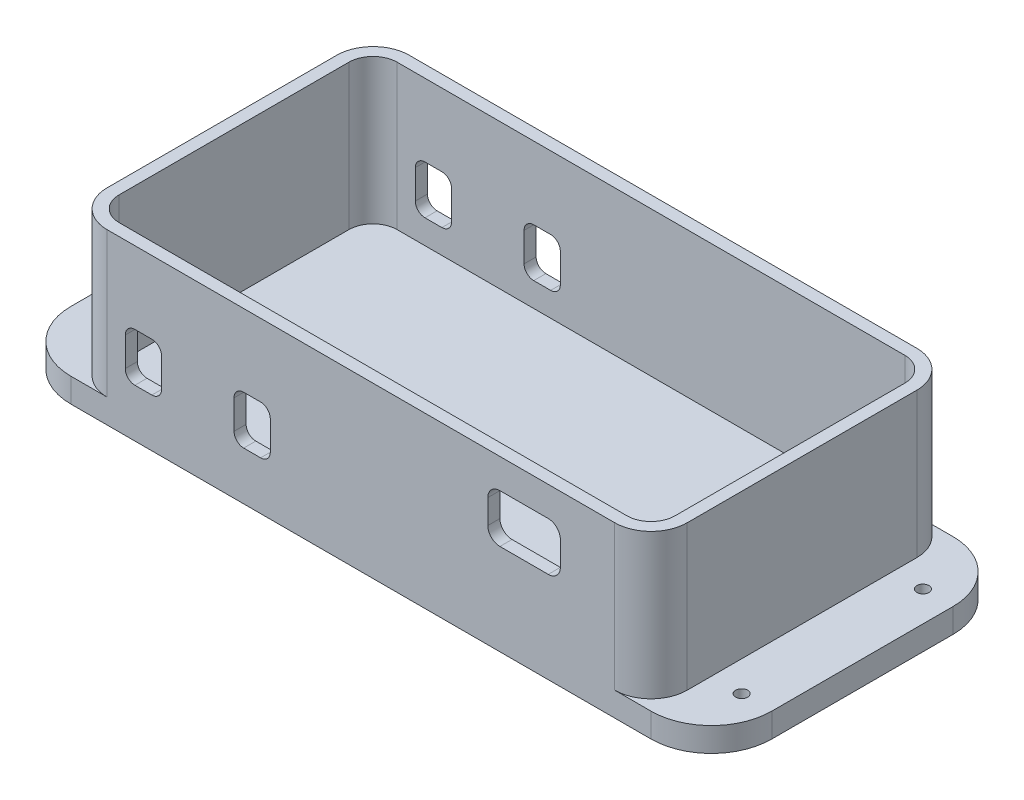
from build123d import *

# Parameters (mm, degrees)
SKETCH1_W            = 147.32
SKETCH1_H            = 63.5
BOSS_EXTRUDE3_DEPTH  = 5.08
FILLET4_R            = 12.7
SKETCH4_W            = 121.92
SKETCH4_H            = 63.5
SKETCH4_W_2          = 116.84
SKETCH4_H_2          = 58.42
BOSS_EXTRUDE4_DEPTH  = 30.48
SKETCH9_W            = 10.16
SKETCH9_H            = 10.16
BOSS_EXTRUDE5_DEPTH  = 5.08
FILLET9_R            = 5.08
SKETCH10_R           = 3.175
CUT_EXTRUDE7_DEPTH   = 163.421034352
FILLET12_R           = 7.62
SKETCH11_R           = 3.175
SKETCH11_R_2         = 1.27
BOSS_EXTRUDE7_DEPTH  = 5.08
SKETCH15_R           = 1.27
CUT_EXTRUDE10_DEPTH  = 2.54
BOSS_EXTRUDE9_START  = -2.54
SKETCH16_R           = 3.175
BOSS_EXTRUDE9_DEPTH  = 2.54
SKETCH17_W           = 116.84
SKETCH17_H           = 58.42
CUT_EXTRUDE11_DEPTH  = 5.08
SKETCH18_W           = 116.84
SKETCH18_H           = 58.42
BOSS_EXTRUDE10_DEPTH = 5.08
FILLET16_R           = 5.08
SKETCH13_W           = 7.62
SKETCH13_H           = 10.16
CUT_EXTRUDE12_DEPTH  = 165.316602935
FILLET17_R           = 2.032
CUT_EXTRUDE14_REACH  = 166.317
SKETCH12_W           = 15.24
SKETCH12_H           = 10.16
FILLET18_R           = 2.54


with BuildPart() as part:
    # Sketch1 → Boss-Extrude3 (new body)
    with BuildSketch(Plane(origin=(0, 0, 0), x_dir=(1, 0, 0), z_dir=(0, 1, 0))):
        with Locations((73.66, 31.75)):
            Rectangle(SKETCH1_W, SKETCH1_H)
    extrude(amount=BOSS_EXTRUDE3_DEPTH)

    # Fillet4
    fillet4_edges = [part.edges().sort_by_distance(p)[0] for p in [
        (0, 2.54, -63.5),
        (147.32, 2.54, -63.5),
        (147.32, 2.54, 0),
        (0, 2.54, 0),
    ]]
    fillet(fillet4_edges, radius=FILLET4_R)

    # Sketch4 → Boss-Extrude4 (add)
    with BuildSketch(Plane(origin=(0, 5.08, 0), x_dir=(1, 0, 0), z_dir=(0, 1, 0))):
        with Locations((73.66, 31.75)):
            Rectangle(SKETCH4_W, SKETCH4_H)
        with Locations((73.66, 31.75)):
            Rectangle(SKETCH4_W_2, SKETCH4_H_2, mode=Mode.SUBTRACT)
    extrude(amount=BOSS_EXTRUDE4_DEPTH)

    # Sketch9 → Boss-Extrude5 (add)
    with BuildSketch(Plane(origin=(0, 5.08, 0), x_dir=(1, 0, 0), z_dir=(0, 1, 0))):
        with Locations((20.32, 55.88)):
            Rectangle(SKETCH9_W, SKETCH9_H)
        with Locations((127, 55.88)):
            Rectangle(SKETCH9_W, SKETCH9_H)
        with Locations((127, 7.62)):
            Rectangle(SKETCH9_W, SKETCH9_H)
        with Locations((20.32, 7.62)):
            Rectangle(SKETCH9_W, SKETCH9_H)
    extrude(amount=BOSS_EXTRUDE5_DEPTH)

    # Fillet9
    fillet9_edges = [part.edges().sort_by_distance(p)[0] for p in [
        (25.4, 7.62, -12.7),
        (25.4, 7.62, -50.8),
        (121.92, 7.62, -50.8),
        (121.92, 7.62, -12.7),
    ]]
    fillet(fillet9_edges, radius=FILLET9_R)

    # Sketch10 → Cut-Extrude7 (cut, through all)
    with BuildSketch(Plane(origin=(0, 10.16, 0), x_dir=(1, 0, 0), z_dir=(0, 1, 0))):
        with Locations(Location((20.32, 55.88, 0), (0, 0, 270))):
            Circle(SKETCH10_R)
        with Locations(Location((127, 55.88, 0), (0, 0, 270))):
            Circle(SKETCH10_R)
        with Locations(Location((20.32, 7.62, 0), (0, 0, 270))):
            Circle(SKETCH10_R)
        with Locations(Location((127, 7.62, 0), (0, 0, 270))):
            Circle(SKETCH10_R)
    extrude(amount=-CUT_EXTRUDE7_DEPTH, mode=Mode.SUBTRACT)

    # Fillet12
    fillet12_edges = [part.edges().sort_by_distance(p)[0] for p in [
        (12.7, 20.32, -63.5),
        (12.7, 20.32, 0),
        (134.62, 20.32, 0),
        (134.62, 20.32, -63.5),
    ]]
    fillet(fillet12_edges, radius=FILLET12_R)

    # Sketch11 → Boss-Extrude7 (add)
    # profile 1 of 4: a face of its own
    with BuildSketch(Plane(origin=(0, 10.16, 0), x_dir=(1, 0, 0), z_dir=(0, 1, 0))):
        with Locations(Location((20.32, 55.88, 0), (0, 0, 270))):
            Circle(SKETCH11_R)
        with Locations(Location((20.32, 55.88, 0), (0, 0, 270))):
            Circle(SKETCH11_R_2, mode=Mode.SUBTRACT)
    # profile 2 of 4: a face of its own
    with BuildSketch(Plane(origin=(0, 10.16, 0), x_dir=(1, 0, 0), z_dir=(0, 1, 0))):
        with Locations(Location((127, 55.88, 0), (0, 0, 270))):
            Circle(SKETCH11_R)
        with Locations(Location((127, 55.88, 0), (0, 0, 270))):
            Circle(SKETCH11_R_2, mode=Mode.SUBTRACT)
    # profile 3 of 4: a face of its own
    with BuildSketch(Plane(origin=(0, 10.16, 0), x_dir=(1, 0, 0), z_dir=(0, 1, 0))):
        with Locations(Location((20.32, 7.62, 0), (0, 0, 270))):
            Circle(SKETCH11_R)
        with Locations(Location((20.32, 7.62, 0), (0, 0, 270))):
            Circle(SKETCH11_R_2, mode=Mode.SUBTRACT)
    # profile 4 of 4: a face of its own
    with BuildSketch(Plane(origin=(0, 10.16, 0), x_dir=(1, 0, 0), z_dir=(0, 1, 0))):
        with Locations(Location((127, 7.62, 0), (0, 0, 270))):
            Circle(SKETCH11_R)
        with Locations(Location((127, 7.62, 0), (0, 0, 270))):
            Circle(SKETCH11_R_2, mode=Mode.SUBTRACT)
    extrude(amount=-BOSS_EXTRUDE7_DEPTH)

    # Sketch15 → Cut-Extrude10 (cut)
    with BuildSketch(Plane(origin=(0, 5.08, 0), x_dir=(1, 0, 0), z_dir=(0, 1, 0))):
        with Locations(Location((6.35, 50.8, 0), (0, 0, 270))):
            Circle(SKETCH15_R)
        with Locations(Location((6.35, 12.7, 0), (0, 0, 270))):
            Circle(SKETCH15_R)
        with Locations(Location((140.97, 12.7, 0), (0, 0, 90))):
            Circle(SKETCH15_R)
        with Locations(Location((140.97, 50.8, 0), (0, 0, 90))):
            Circle(SKETCH15_R)
    extrude(amount=-CUT_EXTRUDE10_DEPTH, mode=Mode.SUBTRACT)

    # Sketch16 → Boss-Extrude9 (add)
    with BuildSketch(Plane.XZ.offset(BOSS_EXTRUDE9_START)):
        with Locations(Location((20.32, -7.62, 0), (0, 0, 90))):
            Circle(SKETCH16_R)
        with Locations(Location((127, -7.62, 0), (0, 0, 90))):
            Circle(SKETCH16_R)
        with Locations(Location((20.32, -55.88, 0), (0, 0, 90))):
            Circle(SKETCH16_R)
        with Locations(Location((127, -55.88, 0), (0, 0, 90))):
            Circle(SKETCH16_R)
    extrude(amount=BOSS_EXTRUDE9_DEPTH)

    # Sketch17 → Cut-Extrude11 (cut)
    with BuildSketch(Plane(origin=(0, 10.16, 0), x_dir=(1, 0, 0), z_dir=(0, 1, 0))):
        with Locations((73.66, 31.75)):
            Rectangle(SKETCH17_W, SKETCH17_H)
    extrude(amount=-CUT_EXTRUDE11_DEPTH, mode=Mode.SUBTRACT)

    # Sketch18 → Boss-Extrude10 (add)
    with BuildSketch(Plane(origin=(0, 5.08, 0), x_dir=(1, 0, 0), z_dir=(0, 1, 0))):
        with Locations((73.66, 31.75)):
            Rectangle(SKETCH18_W, SKETCH18_H)
    extrude(amount=-BOSS_EXTRUDE10_DEPTH)

    # Fillet16
    fillet16_edges = [part.edges().sort_by_distance(p)[0] for p in [
        (15.24, 20.32, -2.54),
        (132.08, 20.32, -2.54),
        (132.08, 20.32, -60.96),
        (15.24, 20.32, -60.96),
    ]]
    fillet(fillet16_edges, radius=FILLET16_R)

    # Sketch13 → Cut-Extrude12 (cut, through all)
    with BuildSketch(Plane.XY):
        with Locations((27.94, 15.24)):
            Rectangle(SKETCH13_W, SKETCH13_H)
        with Locations((50.8, 15.24)):
            Rectangle(SKETCH13_W, SKETCH13_H)
    extrude(amount=-CUT_EXTRUDE12_DEPTH, mode=Mode.SUBTRACT)

    # Fillet17
    fillet17_edges = [part.edges().sort_by_distance(p)[0] for p in [
        (24.13, 10.16, -1.27),
        (24.13, 20.32, -1.27),
        (31.75, 20.32, -1.27),
        (31.75, 10.16, -1.27),
        (24.13, 10.16, -62.23),
        (24.13, 20.32, -62.23),
        (31.75, 20.32, -62.23),
        (31.75, 10.16, -62.23),
        (46.99, 10.16, -1.27),
        (46.99, 20.32, -1.27),
        (54.61, 20.32, -1.27),
        (54.61, 10.16, -1.27),
        (46.99, 10.16, -62.23),
        (46.99, 20.32, -62.23),
        (54.61, 20.32, -62.23),
        (54.61, 10.16, -62.23),
    ]]
    fillet(fillet17_edges, radius=FILLET17_R)

    # Sketch12 → Cut-Extrude14 (cut, up to next)
    with BuildSketch(Plane.XY, mode=Mode.PRIVATE) as cut_extrude14_sk1:
        with Locations((107.95, 24.257)):
            Rectangle(SKETCH12_W, SKETCH12_H)
    cut_extrude14_tool1 = extrude(cut_extrude14_sk1.sketch, amount=-CUT_EXTRUDE14_REACH, mode=Mode.PRIVATE) & part.part
    add(cut_extrude14_tool1.solids().sort_by_distance((107.95, 24.257, 0))[0], mode=Mode.SUBTRACT)

    # Fillet18
    fillet18_edges = [part.edges().sort_by_distance(p)[0] for p in [
        (100.33, 19.177, -1.27),
        (100.33, 29.337, -1.27),
        (115.57, 29.337, -1.27),
        (115.57, 19.177, -1.27),
    ]]
    fillet(fillet18_edges, radius=FILLET18_R)


solid = part.part
